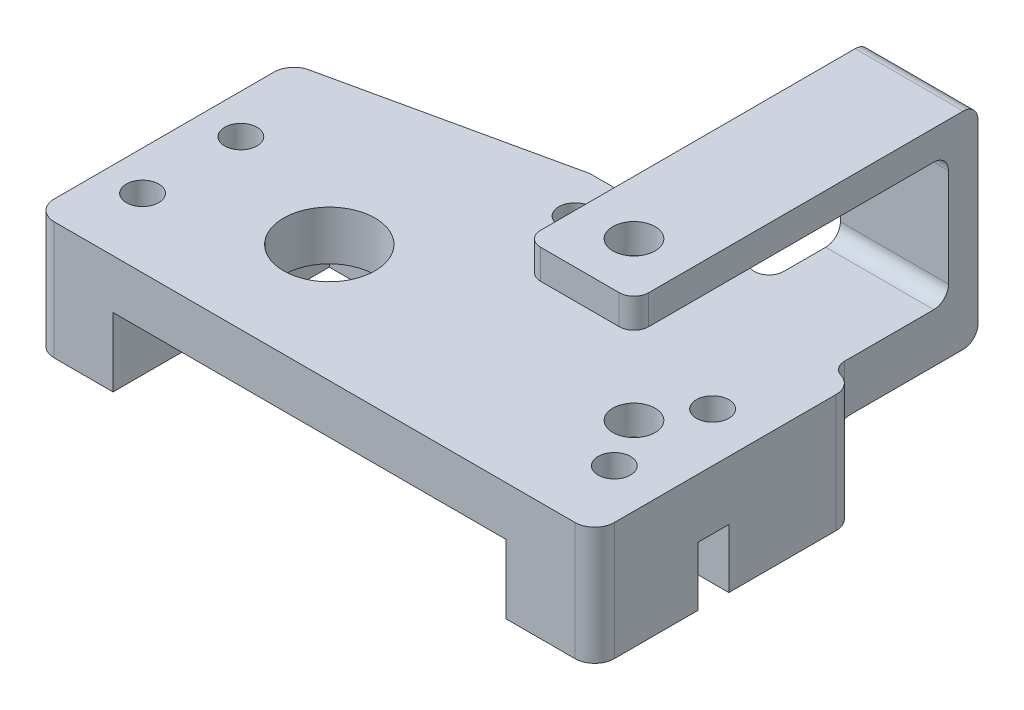
from build123d import *

# Parameters (mm, degrees)
SKETCH_1_R           = 1.6500000000000006
SKETCH_1_R_2         = 1.6500000000000001
SKETCH_1_R_3         = 1.6500000000000028
SKETCH_1_R_4         = 1.6500000000000017
SKETCH_1_R_5         = 1.6499999999999986
SKETCH_1_R_6         = 1.6499999999999955
EXTRUDE_1_DEPTH      = 12
CUT_EXTRUDE_1_DEPTH  = 8
FILLET_1_R           = 2
SKETCH_5_R           = 1.5499999999999978
EXTRUDE_3_DEPTH      = 5
SKETCH_5_R_2         = 1.5500000000000012
EXTRUDE_3_2_DEPTH    = 5
SKETCH_5_R_3         = 4.656253475136203
EXTRUDE_3_3_DEPTH    = 5
SKETCH_7_R           = 3.149999999999999
CUT_EXTRUDE_2_DEPTH  = 2
SKETCH_8_W           = 8
SKETCH_8_H           = 3
SKETCH_8_W_2         = 5.29999999999999
SKETCH_8_H_2         = 3.1337502138362687
CUT_EXTRUDE_3_DEPTH  = 6
SKETCH_6_R           = 1.5499999999999974
SKETCH_6_R_2         = 1.5500000000000012
CUT_EXTRUDE_4_DEPTH  = 10
EXTRUDE_9_DEPTH      = 10
EXTRUDE_9_DEPTH_BACK = 10
SKETCH_18_W          = 11.000000000000007
SKETCH_18_H          = 3
EXTRUDE_10_DEPTH     = 16
SKETCH_19_W          = 11.000000000000007
SKETCH_19_H          = 3
EXTRUDE_11_DEPTH     = 32
SKETCH_20_R          = 2.1500000000000012
CUT_EXTRUDE_7_DEPTH  = 22
FILLET_4_R           = 1.5


with BuildPart() as part:
    # 草图1 → 凸台-拉伸1 (new body)
    with BuildSketch(Plane(origin=(0, 0, 0), x_dir=(1, 0, 0), z_dir=(0, 1, 0))):
        with BuildLine():
            Line((0, 0), (25, 5.5))
            Line((25, 5.5), (41, 5.5))
            Line((41, 5.5), (57, 0))
            Line((57, 0), (57, -26.000000000000004))
            Line((57, -26.000000000000004), (48, -26.000000000000004))
            Line((48, -26.000000000000004), (48, -17.000000000000004))
            ThreePointArc((48, -17.000000000000004), (52.16227766016838, -14.000000000000004), (48, -11.000000000000004))
            Line((48, -11.000000000000004), (48, -4.0000000000000036))
            Line((48, -4.0000000000000036), (8.000000000000004, -4.0000000000000036))
            Line((8.000000000000004, -4.0000000000000036), (8.000000000000004, -26.000000000000004))
            Line((8.000000000000004, -26.000000000000004), (0, -26.000000000000004))
            Line((0, -26.000000000000004), (0, 0))
        make_face()
        with Locations(Location((4.000000000000001, -9.000000000000002, 0), (0, 0, 270))):
            Circle(SKETCH_1_R, mode=Mode.SUBTRACT)
        with Locations(Location((4.000000000000001, -19.000000000000004, 0), (0, 0, 270))):
            Circle(SKETCH_1_R_2, mode=Mode.SUBTRACT)
        with Locations(Location((52.00000000000001, -9.000000000000002, 0), (0, 0, 270))):
            Circle(SKETCH_1_R_3, mode=Mode.SUBTRACT)
        with Locations(Location((52.00000000000001, -19.000000000000004, 0), (0, 0, 270))):
            Circle(SKETCH_1_R_4, mode=Mode.SUBTRACT)
        with Locations(Location((28, 0.9999999999999966, 0), (0, 0, 270))):
            Circle(SKETCH_1_R_5, mode=Mode.SUBTRACT)
        with Locations(Location((38, 0.9999999999999966, 0), (0, 0, 270))):
            Circle(SKETCH_1_R_6, mode=Mode.SUBTRACT)
    extrude(amount=EXTRUDE_1_DEPTH)

    # 草图2 → 切除-拉伸1 (cut)
    with BuildSketch(Plane(origin=(0, 0, 0), x_dir=(-1, 0, 0), z_dir=(0, -1, 0))):
        Polygon((-26.614359353944906, -1.400000000000001), (-25.2287187078898, 1.0000000000000004), (-26.614359353944902, 3.399999999999998), (-29.3856406460551, 3.399999999999998), (-30.771281292110206, 1), (-29.3856406460551, -1.4000000000000015), align=None)
        Polygon((-36.6143593539449, -1.400000000000001), (-35.2287187078898, 1.0000000000000004), (-36.6143593539449, 3.399999999999998), (-39.385640646055094, 3.399999999999998), (-40.7712812921102, 1), (-39.385640646055094, -1.4000000000000015), align=None)
    extrude(amount=-CUT_EXTRUDE_1_DEPTH, mode=Mode.SUBTRACT)

    # 圆角1
    fillet_1_edges = [part.edges().sort_by_distance(p)[0] for p in [
        (0, 6, 0),
        (25, 6, -5.5),
        (41, 6, -5.5),
        (57, 6, 0),
        (57, 6, 26.000000000000004),
        (0, 6, 26.000000000000004),
    ]]
    fillet(fillet_1_edges, radius=FILLET_1_R)

    # 草图8 → 切除-拉伸3 (cut)
    with BuildSketch(Plane(origin=(0, 0, 0), x_dir=(-1, 0, 0), z_dir=(0, -1, 0))):
        with Locations((-4.0000000000000036, -13.662025546184847)):
            Rectangle(SKETCH_8_W, SKETCH_8_H)
        with Locations((-54.35000000000001, -13.920667343602716)):
            Rectangle(SKETCH_8_W_2, SKETCH_8_H_2)
    extrude(amount=-CUT_EXTRUDE_3_DEPTH, mode=Mode.SUBTRACT)



with BuildPart() as body_2:
    # 草图5 → 凸台-拉伸3 (new body)
    with BuildSketch(Plane(origin=(0, 12, 0), x_dir=(1, 0, 0), z_dir=(0, 1, 0))):
        with Locations(Location((28, 0.9999999999999966, 0), (0, 0, 270))):
            Circle(SKETCH_5_R)
    extrude(amount=-EXTRUDE_3_DEPTH)


with BuildPart() as body_3:
    # 草图5 → Extrude 3 2 (new body)
    with BuildSketch(Plane(origin=(0, 12, 0), x_dir=(1, 0, 0), z_dir=(0, 1, 0))):
        with Locations(Location((38, 0.9999999999999966, 0), (0, 0, 270))):
            Circle(SKETCH_5_R_2)
    extrude(amount=-EXTRUDE_3_2_DEPTH)


with BuildPart() as body_4:
    # 草图5 → Extrude 3 3 (new body)
    with BuildSketch(Plane(origin=(0, 12, 0), x_dir=(1, 0, 0), z_dir=(0, 1, 0))):
        with BuildLine():
            Line((48, -11.000000000000004), (48, -4.0000000000000036))
            Line((48, -4.0000000000000036), (8.000000000000004, -4.0000000000000036))
            Line((8.000000000000004, -4.0000000000000036), (8.000000000000004, -26.000000000000004))
            Line((8.000000000000004, -26.000000000000004), (48, -26.000000000000004))
            Line((48, -26.000000000000004), (48, -17.000000000000004))
            ThreePointArc((48, -17.000000000000004), (52.16227766016838, -14.000000000000004), (48, -11.000000000000004))
        make_face()
        with Locations(Location((49, -14.000000000000004, 0), (0, 0, 270))):
            Circle(SKETCH_5_R_2, mode=Mode.SUBTRACT)
        with Locations(Location((18, -14.000000000000002, 0), (0, 0, 270))):
            Circle(SKETCH_5_R_3, mode=Mode.SUBTRACT)
    extrude(amount=-EXTRUDE_3_3_DEPTH)

    # 草图7 → 切除-拉伸2 (cut)
    with BuildSketch(Plane(origin=(0, 7, 0), x_dir=(-1, 0, 0), z_dir=(0, -1, 0))):
        with Locations(Location((-49, -14.000000000000004, 0), (0, 0, 90))):
            Circle(SKETCH_7_R)
    extrude(amount=-CUT_EXTRUDE_2_DEPTH, mode=Mode.SUBTRACT)


with BuildPart() as cut_extrude_4_tool:
    # 草图6 → 切除-拉伸4 (new body)
    with BuildSketch(Plane(origin=(0, 7, 0), x_dir=(-1, 0, 0), z_dir=(0, -1, 0))):
        with Locations((-28, 0.9999999999999966)):
            Circle(SKETCH_6_R)
        with Locations((-38, 0.9999999999999966)):
            Circle(SKETCH_6_R_2)
    extrude(amount=-CUT_EXTRUDE_4_DEPTH)


with BuildPart() as body_2_1:
    add(body_2.part)

    # 切除-拉伸4: cut by cut_extrude_4_tool
    add(cut_extrude_4_tool.part, mode=Mode.SUBTRACT)


with BuildPart() as body_3_1:
    add(body_3.part)

    # 切除-拉伸4: cut by cut_extrude_4_tool
    add(cut_extrude_4_tool.part, mode=Mode.SUBTRACT)


with BuildPart() as part_1:
    add(part.part)

    add(body_4.part)  # 凸台-拉伸9 merges body 4
    # 草图17 → 凸台-拉伸9 (add, two sides: drawn at the far end of the back side and taken through both)
    with BuildSketch(Plane(origin=(0, 0, -5.5), x_dir=(-1, 0, 0), z_dir=(0, 0, -1)).offset(-EXTRUDE_9_DEPTH_BACK)):
        Polygon((-43.5, 12), (-54.5, 11.999999999999998), (-54.5, 6.999999999999999), (-43.5, 9.000000000000002), align=None)
    extrude(amount=EXTRUDE_9_DEPTH + EXTRUDE_9_DEPTH_BACK)

    # 草图18 → 凸台-拉伸10 (add)
    with BuildSketch(Plane(origin=(0, 12, 0), x_dir=(1, 0, 0), z_dir=(0, 1, 0))):
        with Locations((49, 14.000000000000002)):
            Rectangle(SKETCH_18_W, SKETCH_18_H)
    extrude(amount=EXTRUDE_10_DEPTH)

    # 草图19 → 凸台-拉伸11 (add)
    with BuildSketch(Plane.XY.offset(-12.5)):
        with Locations((49, 26.500000000000004)):
            Rectangle(SKETCH_19_W, SKETCH_19_H)
    extrude(amount=EXTRUDE_11_DEPTH)

    # 草图20 → 切除-拉伸7 (cut)
    with BuildSketch(Plane(origin=(0, 28, 0), x_dir=(1, 0, 0), z_dir=(0, 1, 0))):
        with Locations(Location((49, -14.000000000000004, 0), (0, 0, 270))):
            Circle(SKETCH_20_R)
    extrude(amount=-CUT_EXTRUDE_7_DEPTH, mode=Mode.SUBTRACT)

    # 圆角4
    fillet_4_edges = [part_1.edges().sort_by_distance(p)[0] for p in [
        (49, 12, -12.5),
        (49, 28, -15.5),
        (49, 25, -12.5),
        (43.5, 26.5, 19.5),
        (54.5, 26.5, 19.5),
        (49, 8, -15.5),
        (54.5, 9.499999999999998, -0.8593749999999969),
        (49, 8, -2.749999999999998),
        (43.5, 10.5, -4.640624999999999),
    ]]
    fillet(fillet_4_edges, radius=FILLET_4_R)


solid = part_1.part
